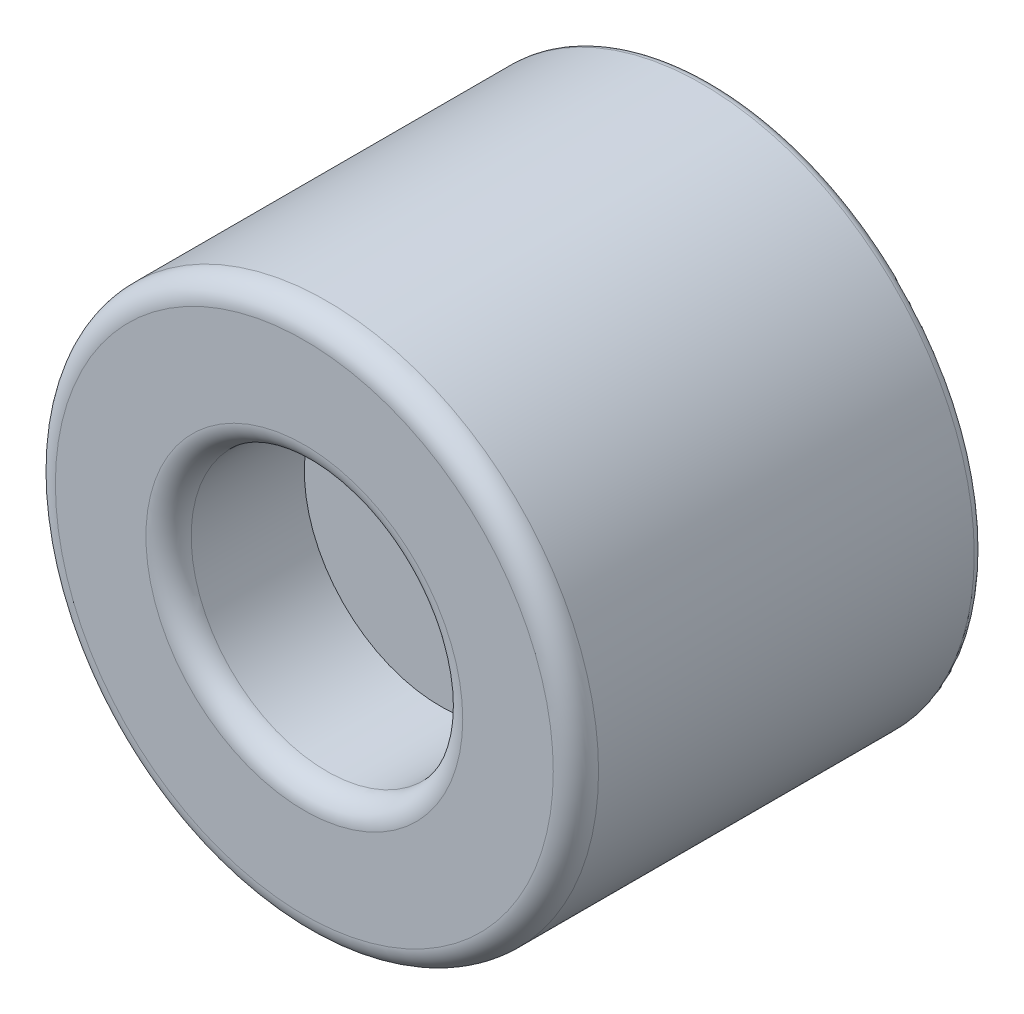
from build123d import *

# Parameters (mm, degrees)
SKETCH_1_R          = 6
SKETCH_1_R_2        = 4.5
EXTRUDE_1_DEPTH     = 3
SKETCH_2_R          = 6
EXTRUDE_2_DEPTH     = 6
SKETCH_3_R          = 3
CUT_EXTRUDE_1_DEPTH = 3
FILLET_1_R          = 0.5
FILLET_2_R          = 0.5
FILLET_3_R          = 0.2


with BuildPart() as part:
    # 草图1 → 凸台-拉伸1 (new body)
    with BuildSketch(Plane.XY):
        Circle(SKETCH_1_R)
        Circle(SKETCH_1_R_2, mode=Mode.SUBTRACT)
    extrude(amount=EXTRUDE_1_DEPTH)

    # 草图2 → 凸台-拉伸2 (add)
    with BuildSketch(Plane.XY.offset(3)):
        Circle(SKETCH_2_R)
    extrude(amount=EXTRUDE_2_DEPTH)

    # 草图3 → 切除-拉伸1 (cut)
    with BuildSketch(Plane.XY.offset(9)):
        Circle(SKETCH_3_R)
    extrude(amount=-CUT_EXTRUDE_1_DEPTH, mode=Mode.SUBTRACT)

    # 圆角1
    fillet_1_edges = [part.edges().sort_by_distance(p)[0] for p in [
        (-3, 0, 9),
    ]]
    fillet(fillet_1_edges, radius=FILLET_1_R)

    # 圆角2
    fillet_2_edges = [part.edges().sort_by_distance(p)[0] for p in [
        (-6, 0, 9),
    ]]
    fillet(fillet_2_edges, radius=FILLET_2_R)

    # 圆角3
    fillet_3_edges = [part.edges().sort_by_distance(p)[0] for p in [
        (-6, 0, 0),
        (-4.5, 0, 0),
    ]]
    fillet(fillet_3_edges, radius=FILLET_3_R)


solid = part.part
